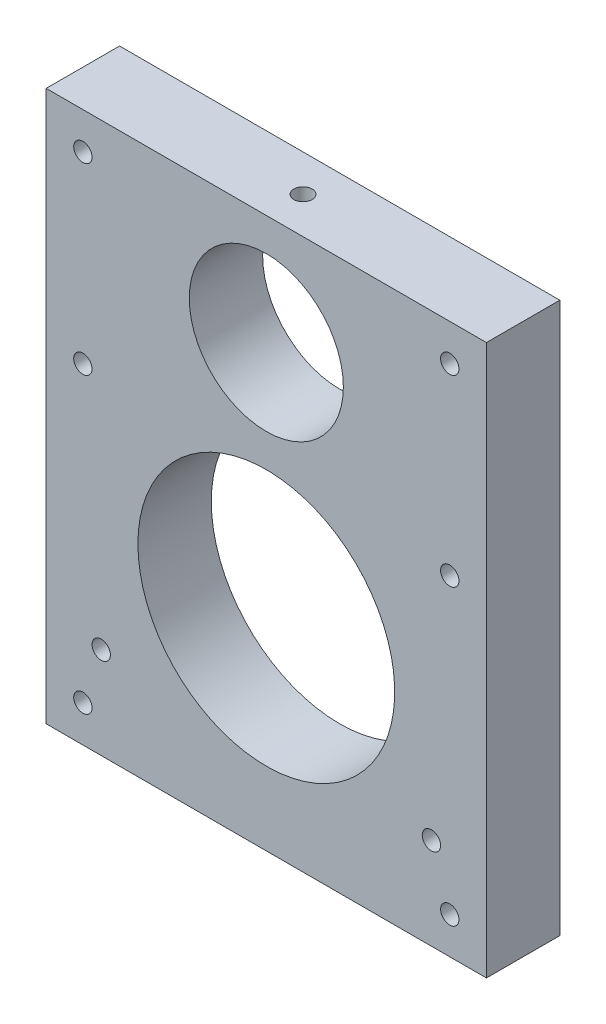
from build123d import *

# Parameters (mm, degrees)
SKETCH1_W               = 152.4
SKETCH1_H               = 190.5
BOSS_EXTRUDE1_DEPTH     = 25.4
SKETCH2_R               = 26.67
CUT_EXTRUDE1_DEPTH      = 125.595997127
CUT_EXTRUDE3_DEPTH      = 125.595997127
CUT_EXTRUDE3_DEPTH_BACK = 125.595997127
SKETCH3_R               = 3.175
CUT_EXTRUDE4_DEPTH      = 125.595997127
CUT_EXTRUDE4_DEPTH_BACK = 125.595997127
SKETCH4_R               = 44.45
CUT_EXTRUDE5_DEPTH      = 125.595997127
CUT_EXTRUDE5_DEPTH_BACK = 125.595997127
SKETCH6_R               = 3.175
CUT_EXTRUDE6_DEPTH      = 125.595997127
CUT_EXTRUDE6_DEPTH_BACK = 125.595997127
SKETCH7_R               = 3.175
SKETCH8_R               = 3.175
CUT_EXTRUDE7_DEPTH      = 25.4


with BuildPart() as part:
    # Sketch1 → Boss-Extrude1 (new body)
    with BuildSketch(Plane.XY):
        Rectangle(SKETCH1_W, SKETCH1_H)
    extrude(amount=BOSS_EXTRUDE1_DEPTH)

    # Sketch2 → Cut-Extrude1 (cut, through all)
    with BuildSketch(Plane(origin=(0, 0, 0), x_dir=(-1, 0, 0), z_dir=(0, 0, -1))):
        with Locations((0, 57.15)):
            Circle(SKETCH2_R)
    extrude(amount=-CUT_EXTRUDE1_DEPTH, mode=Mode.SUBTRACT)

    # Sketch3 → Cut-Extrude3 (cut, two sides: drawn at the far end of the back side and taken through both)
    with BuildSketch(Plane(origin=(0, 0, 0), x_dir=(-1, 0, 0), z_dir=(0, 0, -1)).offset(-CUT_EXTRUDE3_DEPTH_BACK)):
        with Locations((-63.5, 82.55)):
            Circle(SKETCH3_R)
        with Locations((63.5, 82.55)):
            Circle(SKETCH3_R)
        with Locations((63.5, -82.55)):
            Circle(SKETCH3_R)
        with Locations((-63.5, -82.55)):
            Circle(SKETCH3_R)
    extrude(amount=CUT_EXTRUDE3_DEPTH + CUT_EXTRUDE3_DEPTH_BACK, mode=Mode.SUBTRACT)

    # Sketch4 → Cut-Extrude4 (cut, two sides: drawn at the far end of the back side and taken through both)
    with BuildSketch(Plane(origin=(0, 0, 0), x_dir=(-1, 0, 0), z_dir=(0, 0, -1)).offset(-CUT_EXTRUDE4_DEPTH_BACK)):
        with Locations((0, -25.4)):
            Circle(SKETCH4_R)
    extrude(amount=CUT_EXTRUDE4_DEPTH + CUT_EXTRUDE4_DEPTH_BACK, mode=Mode.SUBTRACT)

    # Sketch6 → Cut-Extrude5 (cut, two sides: drawn at the far end of the back side and taken through both)
    with BuildSketch(Plane(origin=(0, 0, 0), x_dir=(-1, 0, 0), z_dir=(0, 0, -1)).offset(-CUT_EXTRUDE5_DEPTH_BACK)):
        with Locations((-63.5, 19.05)):
            Circle(SKETCH6_R)
        with Locations((63.5, 19.05)):
            Circle(SKETCH6_R)
    extrude(amount=CUT_EXTRUDE5_DEPTH + CUT_EXTRUDE5_DEPTH_BACK, mode=Mode.SUBTRACT)

    # Sketch7 → Cut-Extrude6 (cut, two sides: drawn at the far end of the back side and taken through both)
    with BuildSketch(Plane(origin=(0, 0, 0), x_dir=(-1, 0, 0), z_dir=(0, 0, -1)).offset(-CUT_EXTRUDE6_DEPTH_BACK)):
        with Locations((-57.15, -63.5)):
            Circle(SKETCH7_R)
        with Locations((57.15, -63.5)):
            Circle(SKETCH7_R)
    extrude(amount=CUT_EXTRUDE6_DEPTH + CUT_EXTRUDE6_DEPTH_BACK, mode=Mode.SUBTRACT)

    # Sketch8 → Cut-Extrude7 (cut)
    with BuildSketch(Plane(origin=(0, 95.25, 0), x_dir=(1, 0, 0), z_dir=(0, 1, 0))):
        with Locations(Location((0, -12.7, 0), (0, 0, 180))):
            Circle(SKETCH8_R)
    extrude(amount=-CUT_EXTRUDE7_DEPTH, mode=Mode.SUBTRACT)


solid = part.part
